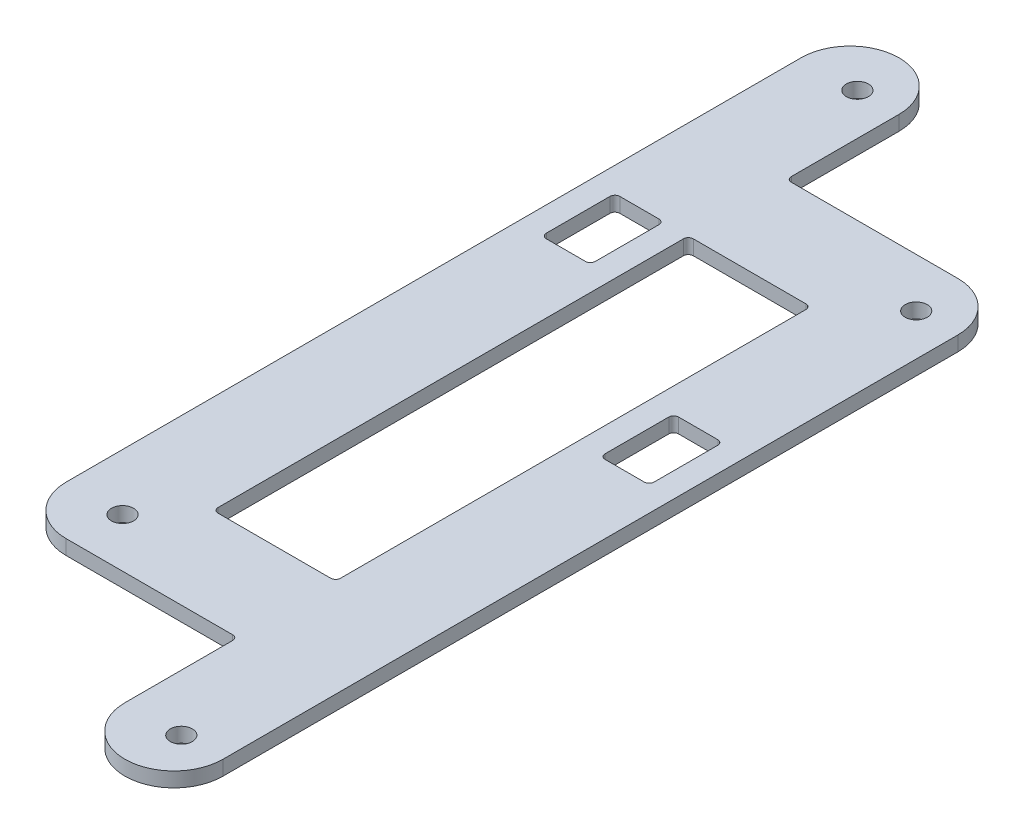
from build123d import *

# Parameters (mm, degrees)
SKETCH1_W            = 25
SKETCH1_H            = 97
BOSS_EXTRUDE1_DEPTH  = 3
SKETCH4_W            = 10
SKETCH4_H            = 15
CUT_EXTRUDE1_DEPTH   = 170.215838502
FILLET2_R            = 1
M4_CLEARANCE_HOLE1_D = 4.5


with BuildPart() as part:
    # Sketch1 → Boss-Extrude1 (new body)
    with BuildSketch(Plane(origin=(0, 0, 0), x_dir=(1, 0, 0), z_dir=(0, 1, 0))):
        with BuildLine():
            Line((-45, -10), (-10, -10))
            Line((-10, -10), (-10, -33))
            ThreePointArc((-10, -33), (0, -43), (10, -33))
            Line((10, -33), (10, 117))
            ThreePointArc((10, 117), (7.071067812, 124.071067812), (0, 127))
            Line((0, 127), (-35, 127))
            Line((-35, 127), (-35, 150))
            ThreePointArc((-35, 150), (-45, 160), (-55, 150))
            Line((-55, 150), (-55, 0))
            ThreePointArc((-55, 0), (-52.071067812, -7.071067812), (-45, -10))
        make_face()
        with Locations((-22.5, 58.5)):
            Rectangle(SKETCH1_W, SKETCH1_H, mode=Mode.SUBTRACT)
    extrude(amount=BOSS_EXTRUDE1_DEPTH)

    # Sketch4 → Cut-Extrude1 (cut, through all)
    with BuildSketch(Plane(origin=(0, 3, 0), x_dir=(1, 0, 0), z_dir=(0, 1, 0))):
        with Locations((-45, 99.5)):
            Rectangle(SKETCH4_W, SKETCH4_H)
        with Locations((0, 66.5)):
            Rectangle(SKETCH4_W, SKETCH4_H)
    extrude(amount=-CUT_EXTRUDE1_DEPTH, mode=Mode.SUBTRACT)

    # Fillet2
    fillet2_edges = [part.edges().sort_by_distance(p)[0] for p in [
        (-35, 1.5, -127),
        (-10, 1.5, 10),
        (-35, 1.5, -107),
        (-35, 1.5, -10),
        (-10, 1.5, -10),
        (-10, 1.5, -107),
        (-50, 1.5, -92),
        (-50, 1.5, -107),
        (-40, 1.5, -107),
        (-40, 1.5, -92),
        (-5, 1.5, -59),
        (-5, 1.5, -74),
        (5, 1.5, -74),
        (5, 1.5, -59),
    ]]
    fillet(fillet2_edges, radius=FILLET2_R)

    # M4 Clearance Hole1 (through all)
    with Locations(Plane(origin=(0, 3, 0), x_dir=(1, 0, 0), z_dir=(0, 1, 0))):
        with Locations((-43.5, 150), (1.5, 117), (-43.5, 0), (1.5, -33)):
            Hole(M4_CLEARANCE_HOLE1_D / 2)


solid = part.part
